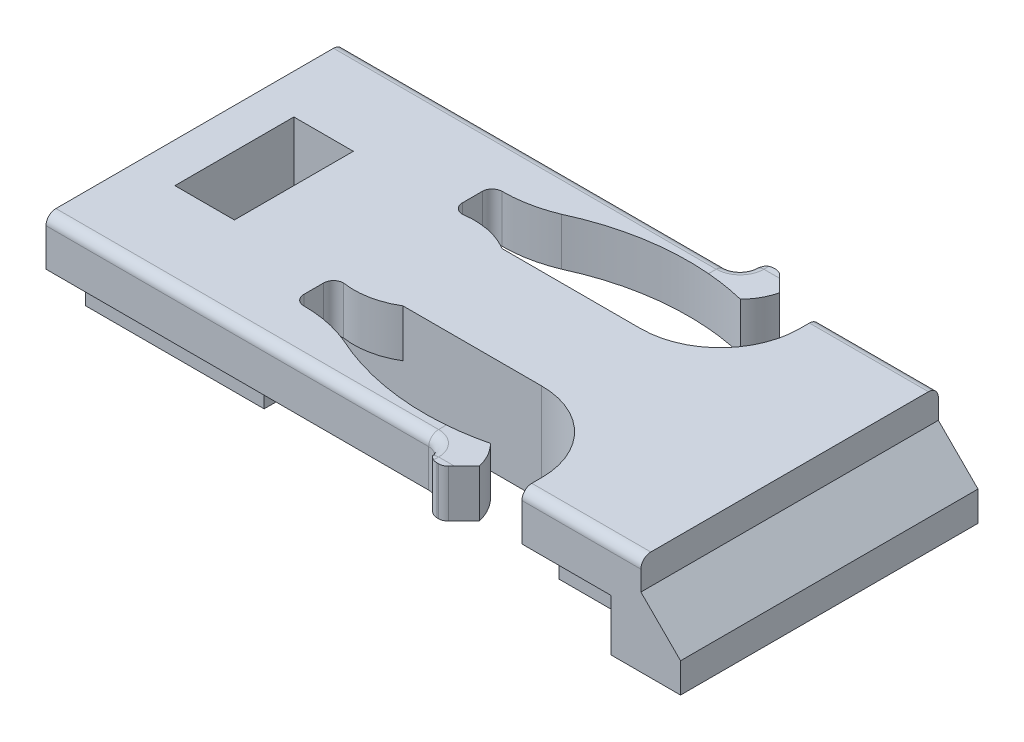
from build123d import *

# Parameters (mm, degrees)
SKETCH_1_W             = 35
SKETCH_1_H             = 15
EXTRUDE_1_DEPTH        = 2.4
FILLET_1_R             = 0.5
SKETCH_2_W             = 35
SKETCH_2_H             = 11
EXTRUDE_2_DEPTH        = 2.6
SKETCH_3_W             = 3.5
SKETCH_3_H             = 2
EXTRUDE_3_DEPTH        = 2.6
CUT_EXTRUDE_1_DEPTH    = 15
CUT_EXTRUDE_2_DEPTH    = 5
CUT_EXTRUDE_3_DEPTH    = 2.4
EXTRUDE_4_DEPTH        = 2.4
CUT_EXTRUDE_4_DEPTH    = 2.4
FILLET_2_R             = 0.5
FILLET_2_OF_MIRROR_2_R = 0.5
SKETCH_17_W            = 3
SKETCH_17_H            = 5
CUT_EXTRUDE_5_DEPTH    = 15
SKETCH_18_W            = 3
SKETCH_18_H            = 6
CUT_EXTRUDE_6_DEPTH    = 5


with BuildPart() as part:
    # 草图1 → 凸台-拉伸1 (new body)
    with BuildSketch(Plane(origin=(0, 0, 0), x_dir=(1, 0, 0), z_dir=(0, 1, 0))):
        with Locations((17.5, 7.5)):
            Rectangle(SKETCH_1_W, SKETCH_1_H)
    extrude(amount=EXTRUDE_1_DEPTH)

    # 圆角1
    fillet_1_edges = [part.edges().sort_by_distance(p)[0] for p in [
        (17.5, 2.4, -15),
        (17.5, 2.4, 0),
    ]]
    fillet(fillet_1_edges, radius=FILLET_1_R)

    # 草图2 → 凸台-拉伸2 (add)
    with BuildSketch(Plane.XZ):
        with Locations((17.5, -7.5)):
            Rectangle(SKETCH_2_W, SKETCH_2_H)
    extrude(amount=EXTRUDE_2_DEPTH)

    # 草图3 → 凸台-拉伸3 (add)
    with BuildSketch(Plane.XZ):
        with Locations((33.25, -1)):
            Rectangle(SKETCH_3_W, SKETCH_3_H)
    extrude_3 = extrude(amount=EXTRUDE_3_DEPTH)

    # 镜向1: 凸台-拉伸3 across plane
    add(extrude_3.mirror(Plane(origin=(0, 0, -7.5), x_dir=(1, 0, 0), z_dir=(0, 0, -1))))

    # 草图4 → 切除-拉伸1 (cut)
    with BuildSketch(Plane(origin=(0, 0, -15), x_dir=(-1, 0, 0), z_dir=(0, 0, -1))):
        Polygon((-35, -1.1), (-33, 0.9), (-33, 2.4), (-35, 2.4), align=None)
    extrude(amount=-CUT_EXTRUDE_1_DEPTH, mode=Mode.SUBTRACT)

    # 草图6 → 切除-拉伸2 (cut)
    with BuildSketch(Plane(origin=(0, 2.4, 0), x_dir=(1, 0, 0), z_dir=(0, 1, 0))):
        with BuildLine():
            Line((12, 15), (27, 15))
            Line((27, 15), (27, 14))
            ThreePointArc((27, 14), (25.828427125, 11.171572875), (23, 10))
            Line((23, 10), (12, 10))
            Line((12, 10), (12, 15))
        make_face()
    cut_extrude_2 = extrude(amount=-CUT_EXTRUDE_2_DEPTH, mode=Mode.SUBTRACT)

    # 扫描4: sweep along a path in 草图13
    with BuildLine(Plane(origin=(0, 2.4, 0), x_dir=(1, 0, 0), z_dir=(0, 1, 0))) as sweep_4_path:
        Line((12, 14.5), (22.3, 14.5))
        ThreePointArc((22.3, 14.5), (23.148528137, 14.851471863), (23.5, 15.7))
        Line((23.5, 15.7), (23.5, 16))
    # 草图10 → 扫描4 (sweep)
    with BuildSketch(Plane(origin=(0, 0, -16), x_dir=(-1, 0, 0), z_dir=(0, 0, -1))):
        with BuildLine():
            Line((-25, 2.4), (-23.5, 2.4))
            ThreePointArc((-23.5, 2.4), (-23.146446609, 2.253553391), (-23, 1.9))
            Line((-23, 1.9), (-23, 0))
            Line((-23, 0), (-25, 0))
            Line((-25, 0), (-25, 2.4))
        make_face()
    sweep_4 = sweep(path=sweep_4_path.line)

    # 草图14 → 切除-拉伸3 (cut)
    with BuildSketch(Plane.XZ):
        Polygon((22.721496019, -16), (22.721496019, -15.221496019), (23.5, -16), align=None)
        Polygon((25.109405679, -16), (25.109405679, -14.890594321), (24, -16), align=None)
    cut_extrude_3 = extrude(amount=-CUT_EXTRUDE_3_DEPTH, mode=Mode.SUBTRACT)

    # 草图15 → 凸台-拉伸4 (add)
    with BuildSketch(Plane.XZ):
        with BuildLine():
            Line((12, -10), (12, -13))
            Line((12, -13), (16, -13))
            ThreePointArc((16, -13), (14.774754878, -12.626225608), (13.5, -12.5))
            ThreePointArc((13.5, -12.5), (13.146446609, -12.353553391), (13, -12))
            Line((13, -12), (13, -11))
            ThreePointArc((13, -11), (13.146446609, -10.646446609), (13.5, -10.5))
            ThreePointArc((13.5, -10.5), (14.794008988, -10.470044942), (16, -10))
            Line((16, -10), (12, -10))
        make_face()
    extrude_4 = extrude(amount=-EXTRUDE_4_DEPTH)

    # 草图16 → 切除-拉伸4 (cut)
    with BuildSketch(Plane.XZ):
        with BuildLine():
            Line((16, -13), (22.3, -13))
            ThreePointArc((22.3, -13), (23.338390931, -13.207662889), (24.217052039, -13.798707945))
            ThreePointArc((24.217052039, -13.798707945), (20.040683481, -14.097313313), (16, -13))
        make_face()
    cut_extrude_4 = extrude(amount=-CUT_EXTRUDE_4_DEPTH, mode=Mode.SUBTRACT)

    # 圆角2
    fillet_2_edges = [part.edges().sort_by_distance(p)[0] for p in [
        (23.5, 1.2, -16),
        (24, 1.2, -16),
    ]]
    fillet(fillet_2_edges, radius=FILLET_2_R)

    # 镜向2: 切除-拉伸2, 扫描4, 切除-拉伸3, 凸台-拉伸4, 切除-拉伸4 across plane
    add(cut_extrude_2.mirror(Plane.XY.offset(-7.5)), mode=Mode.SUBTRACT)
    add(sweep_4.mirror(Plane.XY.offset(-7.5)))
    add(cut_extrude_3.mirror(Plane.XY.offset(-7.5)), mode=Mode.SUBTRACT)
    add(extrude_4.mirror(Plane.XY.offset(-7.5)))
    add(cut_extrude_4.mirror(Plane.XY.offset(-7.5)), mode=Mode.SUBTRACT)

    # 圆角2 of 镜向2
    fillet_2_of_mirror_2_edges = [part.edges().sort_by_distance(p)[0] for p in [
        (23.5, 1.2, 1),
        (24, 1.2, 1),
    ]]
    fillet(fillet_2_of_mirror_2_edges, radius=FILLET_2_OF_MIRROR_2_R)

    # 草图17 → 切除-拉伸5 (cut)
    with BuildSketch(Plane(origin=(0, 0, -15), x_dir=(-1, 0, 0), z_dir=(0, 0, -1))):
        with Locations((-1.5, -0.1)):
            Rectangle(SKETCH_17_W, SKETCH_17_H)
    extrude(amount=-CUT_EXTRUDE_5_DEPTH, mode=Mode.SUBTRACT)

    # 草图18 → 切除-拉伸6 (cut)
    with BuildSketch(Plane(origin=(0, 2.4, 0), x_dir=(1, 0, 0), z_dir=(0, 1, 0))):
        with Locations((6.5, 7.5)):
            Rectangle(SKETCH_18_W, SKETCH_18_H)
    extrude(amount=-CUT_EXTRUDE_6_DEPTH, mode=Mode.SUBTRACT)


solid = part.part
